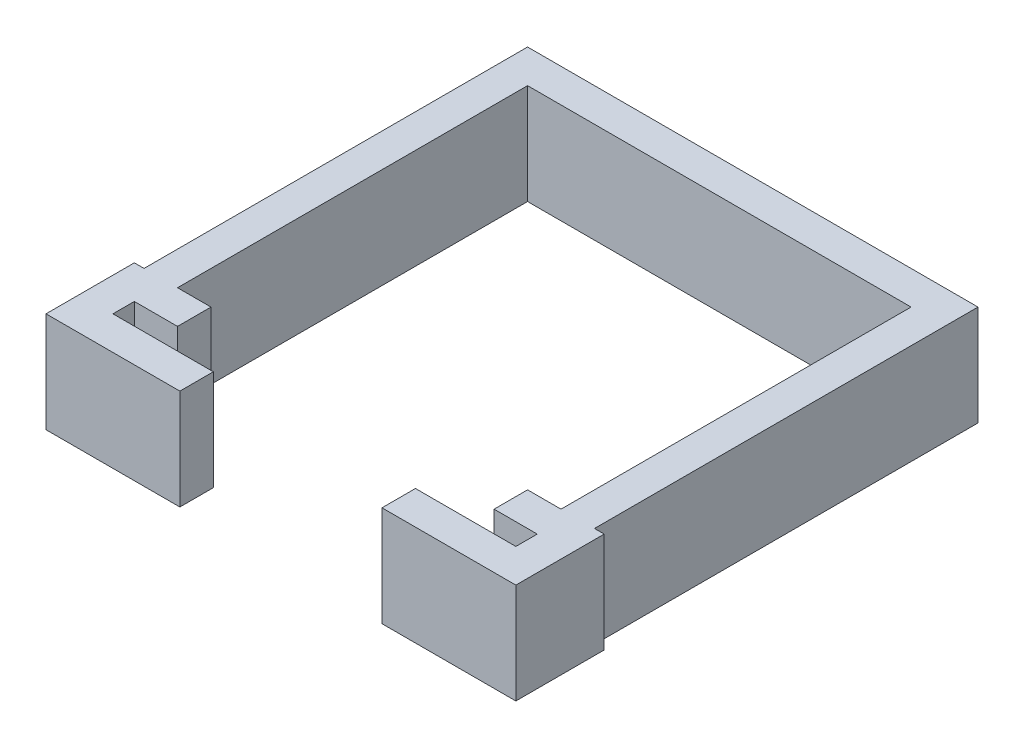
from build123d import *

# Parameters (mm, degrees)
EXTRUDE_1_DEPTH = 15
SKETCH_3_W      = 5
SKETCH_3_H      = 5
EXTRUDE_3_DEPTH = 15
SKETCH_4_R      = 2.15
EXTRUDE_4_DEPTH = 2


with BuildPart() as part:
    # Эскиз1 → Вытянуть1 (new body)
    with BuildSketch(Plane(origin=(0, 0, 0), x_dir=(1, 0, 0), z_dir=(0, 1, 0))):
        Polygon((-5, 5), (-5, 62.3), (62.3, 62.3), (62.3, 5), (63.75, 5), (63.75, -8.2), (43.75, -8.2), (43.75, -3.2), (58.75, -3.2), (58.75, 0), (57.3, 0), (57.3, 57.3), (0, 57.3), (0, 0), (-1.45, 0), (-1.45, -3.2), (13.55, -3.2), (13.55, -8.2), (-6.45, -8.2), (-6.45, 5), align=None)
    extrude(amount=EXTRUDE_1_DEPTH)

    # Эскиз3 → Вытянуть3 (add)
    with BuildSketch(Plane(origin=(0, 0, 0), x_dir=(1, 0, 0), z_dir=(0, 1, 0))):
        with Locations((2.5, 2.5)):
            Rectangle(SKETCH_3_W, SKETCH_3_H)
        with Locations((54.8, 2.5)):
            Rectangle(SKETCH_3_W, SKETCH_3_H)
    extrude(amount=EXTRUDE_3_DEPTH)

    # Эскиз4 → Вытянуть4 (add)
    with BuildSketch(Plane(origin=(0, 0, 3.2), x_dir=(-1, 0, 0), z_dir=(0, 0, -1))):
        with Locations(Location((-8.65, 2.15, 0), (0, 0, 270))):
            Circle(SKETCH_4_R)
        with Locations(Location((-48.65, 2.15, 0), (0, 0, 270))):
            Circle(SKETCH_4_R)
    extrude(amount=EXTRUDE_4_DEPTH)


solid = part.part
